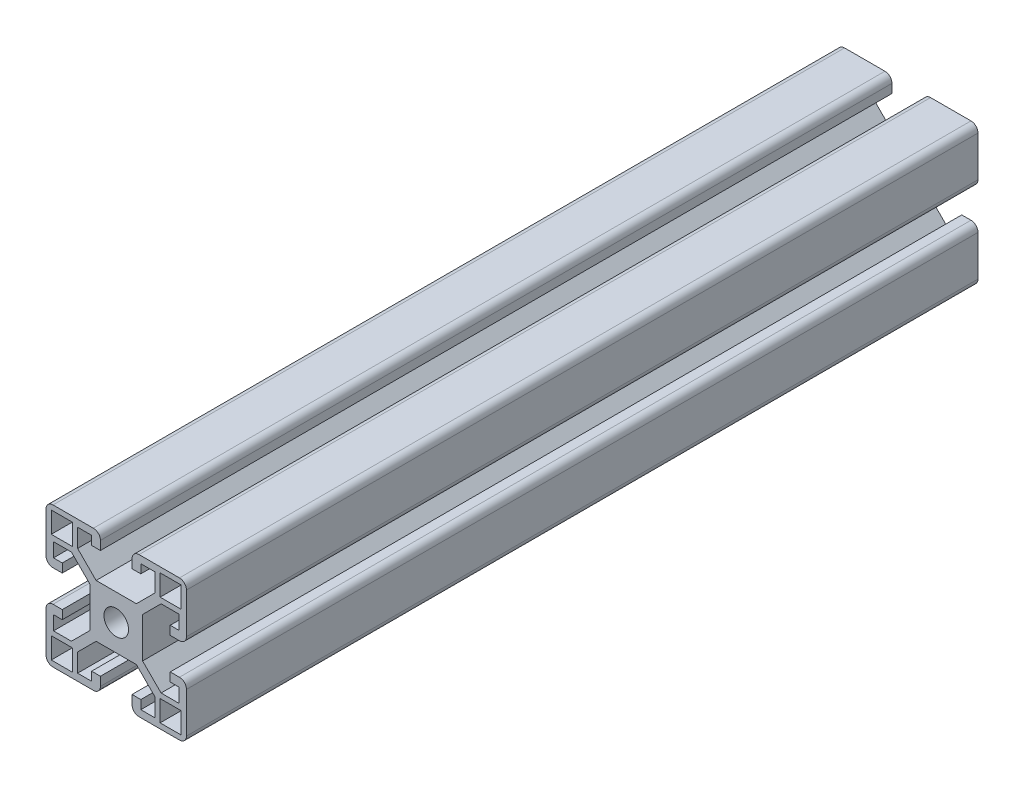
from build123d import *

# Parameters (mm, degrees)
CROQUIS1_W              = 40
CROQUIS1_H              = 40
SALIENTE_EXTRUIR1_DEPTH = 225.4
CROQUIS2_W              = 6
CROQUIS2_H              = 6
CROQUIS2_R              = 3.5
CORTAR_EXTRUIR2_DEPTH   = 225.4
REDONDEO1_R             = 2
REDONDEO2_R             = 2


with BuildPart() as part:
    # Croquis1 → Saliente-Extruir1 (new body)
    with BuildSketch(Plane.XY):
        Rectangle(CROQUIS1_W, CROQUIS1_H)
    extrude(amount=SALIENTE_EXTRUIR1_DEPTH)

    # Croquis2 → Cortar-Extruir2 (cut)
    with BuildSketch(Plane.XY.offset(225.4)):
        with Locations((-15.5, 15.5)):
            Rectangle(CROQUIS2_W, CROQUIS2_H)
        Polygon((4.5, 15.5), (4.5, 20), (-4.5, 20), (-4.5, 15.5), (-7, 15.5), (-7, 18), (-11, 18), (-11, 12.767766953), (-5.733637236, 7.501404189), (5.733637236, 7.501404189), (11, 12.767766953), (11, 18), (7, 18), (7, 15.5), align=None)
        with Locations((15.5, 15.5)):
            Rectangle(CROQUIS2_W, CROQUIS2_H)
        Polygon((15.367588592, -4.5), (20, -4.5), (20, 4.5), (15.367588592, 4.5), (15.367588592, 7), (17.867588592, 7), (17.867588592, 11), (12.767766953, 11), (7.501349817, 5.733582864), (7.501349817, -5.733582864), (12.767766953, -11), (17.867588592, -11), (17.867588592, -7), (15.367588592, -7), align=None)
        Polygon((-20, 4.5), (-20, -4.5), (-15.367588592, -4.5), (-15.367588592, -7), (-17.867588592, -7), (-17.867588592, -11), (-12.767766953, -11), (-7.501349817, -5.733582864), (-7.501349817, 5.733582864), (-12.767766953, 11), (-17.867588592, 11), (-17.867588592, 7), (-15.367588592, 7), (-15.367588592, 4.5), align=None)
        Circle(CROQUIS2_R)
        Polygon((11, -12.767766953), (5.733637236, -7.501404189), (-5.733637236, -7.501404189), (-11, -12.767766953), (-11, -18), (-7, -18), (-7, -15.5), (-4.5, -15.5), (-4.5, -20), (4.5, -20), (4.5, -15.5), (7, -15.5), (7, -18), (11, -18), align=None)
        with Locations((-15.5, -15.5)):
            Rectangle(CROQUIS2_W, CROQUIS2_H)
        with Locations((15.5, -15.5)):
            Rectangle(CROQUIS2_W, CROQUIS2_H)
    extrude(amount=-CORTAR_EXTRUIR2_DEPTH, mode=Mode.SUBTRACT)

    # Redondeo1
    redondeo1_edges = [part.edges().sort_by_distance(p)[0] for p in [
        (20, -20, 112.7),
        (-20, -20, 112.7),
        (-20, 20, 112.7),
        (20, 20, 112.7),
    ]]
    fillet(redondeo1_edges, radius=REDONDEO1_R)

    # Redondeo2
    redondeo2_edges = [part.edges().sort_by_distance(p)[0] for p in [
        (4.5, 20, 112.7),
        (-4.5, 20, 112.7),
        (20, -4.5, 112.7),
        (20, 4.5, 112.7),
        (-20, 4.5, 112.7),
        (-20, -4.5, 112.7),
        (-4.5, -20, 112.7),
        (4.5, -20, 112.7),
    ]]
    fillet(redondeo2_edges, radius=REDONDEO2_R)


solid = part.part
